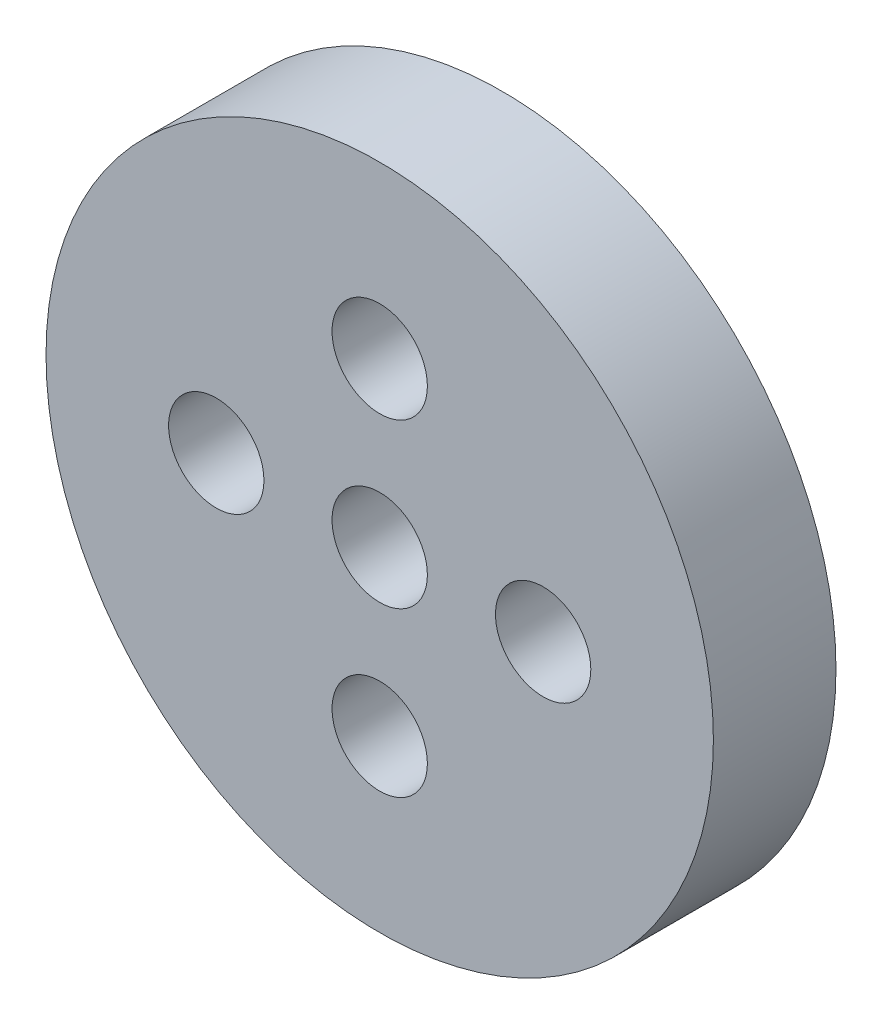
from build123d import *

# Parameters (mm, degrees)
ESBO_O1_R                = 24.5
ESBO_O1_R_2              = 18
ESBO_O1_R_3              = 3.5
RESSALTO_EXTRUS_O1_DEPTH = 9
ESBO_O2_R                = 18
CORTE_EXTRUS_O1_DEPTH    = 2
CORTE_EXTRUS_O1_TAPER    = 45


with BuildPart() as part:
    # Esboço1 → Ressalto-extrusão1 (new body)
    # profile 1 of 2: a face of its own
    with BuildSketch(Plane.XY):
        with Locations((-21.997899875, 9.443861076)):
            Circle(ESBO_O1_R)
        with Locations((-21.997899875, 9.443861076)):
            Circle(ESBO_O1_R_2, mode=Mode.SUBTRACT)
    # profile 2 of 2: a face of its own
    with BuildSketch(Plane.XY):
        with Locations((-21.997899875, 9.443861076)):
            Circle(ESBO_O1_R_2)
        with Locations((-33.997899875, 9.443861076)):
            Circle(ESBO_O1_R_3, mode=Mode.SUBTRACT)
        with Locations((-21.997899875, 21.443861076)):
            Circle(ESBO_O1_R_3, mode=Mode.SUBTRACT)
        with Locations((-9.997899875, 9.443861076)):
            Circle(ESBO_O1_R_3, mode=Mode.SUBTRACT)
        with Locations((-21.997899875, -2.556138924)):
            Circle(ESBO_O1_R_3, mode=Mode.SUBTRACT)
        with Locations((-21.997899875, 9.443861076)):
            Circle(ESBO_O1_R_3, mode=Mode.SUBTRACT)
    extrude(amount=RESSALTO_EXTRUS_O1_DEPTH)

    # Esboço2 → Corte-extrusão1 (cut)
    with BuildSketch(Plane.XY):
        with Locations((-21.997899875, 9.443861076)):
            Circle(ESBO_O2_R)
    extrude(amount=CORTE_EXTRUS_O1_DEPTH, taper=CORTE_EXTRUS_O1_TAPER, mode=Mode.SUBTRACT)


solid = part.part
